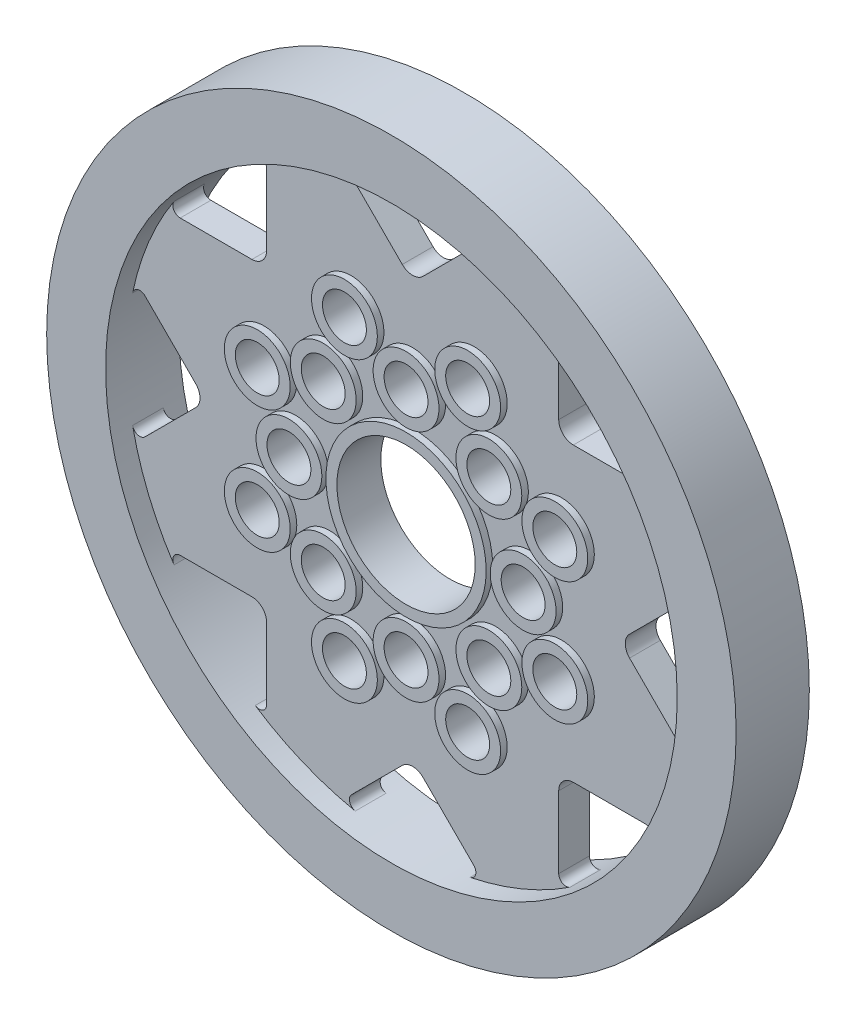
from build123d import *

# Parameters (mm, degrees)
SCHIZZO1_R                   = 23.5494
SCHIZZO1_R_2                 = 19.525
ESTRUSIONE_ESTRUSIONE1_DEPTH = 2.5
SCHIZZO2_R                   = 1.5
SCHIZZO2_R_2                 = 4.725
ESTRUSIONE_ESTRUSIONE2_DEPTH = 1.05
SCHIZZO3_R                   = 2.25
SCHIZZO3_R_2                 = 1.5
SCHIZZO3_R_3                 = 5.475
SCHIZZO3_R_4                 = 4.725
ESTRUSIONE_ESTRUSIONE3_DEPTH = 1.5


with BuildPart() as part:
    # Schizzo1 → Estrusione-Estrusione1 (new, symmetric)
    with BuildSketch(Plane.XY):
        Circle(SCHIZZO1_R)
        Circle(SCHIZZO1_R_2, mode=Mode.SUBTRACT)
    extrude(amount=ESTRUSIONE_ESTRUSIONE1_DEPTH, both=True)

    # Schizzo2 → Estrusione-Estrusione2 (add, symmetric)
    with BuildSketch(Plane.XY):
        with BuildLine():
            ThreePointArc((0.707106781, 14.817893219), (0, 14.525), (-0.707106781, 14.817893219))
            Line((-0.707106781, 14.817893219), (-4.173267549, 18.284053987))
            ThreePointArc((-4.173267549, 18.284053987), (-4.298603069, 18.78136207), (-3.920100864, 19.127426231))
            ThreePointArc((-3.920100864, 19.127426231), (-7.471894017, 18.038747872), (-10.75320289, 16.297062699))
            ThreePointArc((-10.75320289, 16.297062699), (-10.2408571, 16.319999859), (-9.977832778, 15.879724345))
            Line((-9.977832778, 15.879724345), (-9.977832778, 10.977832778))
            ThreePointArc((-9.977832778, 10.977832778), (-10.270725997, 10.270725997), (-10.977832778, 9.977832778))
            Line((-10.977832778, 9.977832778), (-15.879724345, 9.977832778))
            ThreePointArc((-15.879724345, 9.977832778), (-16.319999859, 10.2408571), (-16.297062699, 10.75320289))
            ThreePointArc((-16.297062699, 10.75320289), (-18.038747872, 7.471894017), (-19.127426231, 3.920100864))
            ThreePointArc((-19.127426231, 3.920100864), (-18.78136207, 4.298603069), (-18.284053987, 4.173267549))
            Line((-18.284053987, 4.173267549), (-14.817893219, 0.707106781))
            ThreePointArc((-14.817893219, 0.707106781), (-14.525, 0), (-14.817893219, -0.707106781))
            Line((-14.817893219, -0.707106781), (-18.284053987, -4.173267549))
            ThreePointArc((-18.284053987, -4.173267549), (-18.78136207, -4.298603069), (-19.127426231, -3.920100864))
            ThreePointArc((-19.127426231, -3.920100864), (-18.038747872, -7.471894017), (-16.297062699, -10.75320289))
            ThreePointArc((-16.297062699, -10.75320289), (-16.319999859, -10.2408571), (-15.879724345, -9.977832778))
            Line((-15.879724345, -9.977832778), (-10.977832778, -9.977832778))
            ThreePointArc((-10.977832778, -9.977832778), (-10.270725997, -10.270725997), (-9.977832778, -10.977832778))
            Line((-9.977832778, -10.977832778), (-9.977832778, -15.879724345))
            ThreePointArc((-9.977832778, -15.879724345), (-10.2408571, -16.319999859), (-10.75320289, -16.297062699))
            ThreePointArc((-10.75320289, -16.297062699), (-7.471894017, -18.038747872), (-3.920100864, -19.127426231))
            ThreePointArc((-3.920100864, -19.127426231), (-4.298603069, -18.78136207), (-4.173267549, -18.284053987))
            Line((-4.173267549, -18.284053987), (-0.707106781, -14.817893219))
            ThreePointArc((-0.707106781, -14.817893219), (0, -14.525), (0.707106781, -14.817893219))
            Line((0.707106781, -14.817893219), (4.173267549, -18.284053987))
            ThreePointArc((4.173267549, -18.284053987), (4.298603069, -18.78136207), (3.920100864, -19.127426231))
            ThreePointArc((3.920100864, -19.127426231), (7.471894017, -18.038747872), (10.75320289, -16.297062699))
            ThreePointArc((10.75320289, -16.297062699), (10.2408571, -16.319999859), (9.977832778, -15.879724345))
            Line((9.977832778, -15.879724345), (9.977832778, -10.977832778))
            ThreePointArc((9.977832778, -10.977832778), (10.270725997, -10.270725997), (10.977832778, -9.977832778))
            Line((10.977832778, -9.977832778), (15.879724345, -9.977832778))
            ThreePointArc((15.879724345, -9.977832778), (16.319999859, -10.2408571), (16.297062699, -10.75320289))
            ThreePointArc((16.297062699, -10.75320289), (18.038747872, -7.471894017), (19.127426231, -3.920100864))
            ThreePointArc((19.127426231, -3.920100864), (18.78136207, -4.298603069), (18.284053987, -4.173267549))
            Line((18.284053987, -4.173267549), (14.817893219, -0.707106781))
            ThreePointArc((14.817893219, -0.707106781), (14.525, 0), (14.817893219, 0.707106781))
            Line((14.817893219, 0.707106781), (18.284053987, 4.173267549))
            ThreePointArc((18.284053987, 4.173267549), (18.78136207, 4.298603069), (19.127426231, 3.920100864))
            ThreePointArc((19.127426231, 3.920100864), (18.038747872, 7.471894017), (16.297062699, 10.75320289))
            ThreePointArc((16.297062699, 10.75320289), (16.319999859, 10.2408571), (15.879724345, 9.977832778))
            Line((15.879724345, 9.977832778), (10.977832778, 9.977832778))
            ThreePointArc((10.977832778, 9.977832778), (10.270725997, 10.270725997), (9.977832778, 10.977832778))
            Line((9.977832778, 10.977832778), (9.977832778, 15.879724345))
            ThreePointArc((9.977832778, 15.879724345), (10.2408571, 16.319999859), (10.75320289, 16.297062699))
            ThreePointArc((10.75320289, 16.297062699), (7.471894017, 18.038747872), (3.920100864, 19.127426231))
            ThreePointArc((3.920100864, 19.127426231), (4.298603069, 18.78136207), (4.173267549, 18.284053987))
            Line((4.173267549, 18.284053987), (0.707106781, 14.817893219))
        make_face()
        with Locations((-4.209517756, -10.162674858)):
            Circle(SCHIZZO2_R, mode=Mode.SUBTRACT)
        with Locations((-10.162674858, -4.209517756)):
            Circle(SCHIZZO2_R, mode=Mode.SUBTRACT)
        with Locations((-5.656854249, -5.656854249)):
            Circle(SCHIZZO2_R, mode=Mode.SUBTRACT)
        with Locations((0, -8)):
            Circle(SCHIZZO2_R, mode=Mode.SUBTRACT)
        with Locations((4.209517756, -10.162674858)):
            Circle(SCHIZZO2_R, mode=Mode.SUBTRACT)
        with Locations((5.656854249, -5.656854249)):
            Circle(SCHIZZO2_R, mode=Mode.SUBTRACT)
        with Locations((8, 0)):
            Circle(SCHIZZO2_R, mode=Mode.SUBTRACT)
        with Locations((10.162674858, -4.209517756)):
            Circle(SCHIZZO2_R, mode=Mode.SUBTRACT)
        with Locations((-10.162674858, 4.209517756)):
            Circle(SCHIZZO2_R, mode=Mode.SUBTRACT)
        with Locations((-8, 0)):
            Circle(SCHIZZO2_R, mode=Mode.SUBTRACT)
        with Locations((-5.656854249, 5.656854249)):
            Circle(SCHIZZO2_R, mode=Mode.SUBTRACT)
        with Locations((-4.209517756, 10.162674858)):
            Circle(SCHIZZO2_R, mode=Mode.SUBTRACT)
        Circle(SCHIZZO2_R_2, mode=Mode.SUBTRACT)
        with Locations((0, 8)):
            Circle(SCHIZZO2_R, mode=Mode.SUBTRACT)
        with Locations((5.656854249, 5.656854249)):
            Circle(SCHIZZO2_R, mode=Mode.SUBTRACT)
        with Locations((10.162674858, 4.209517756)):
            Circle(SCHIZZO2_R, mode=Mode.SUBTRACT)
        with Locations((4.209517756, 10.162674858)):
            Circle(SCHIZZO2_R, mode=Mode.SUBTRACT)
    extrude(amount=ESTRUSIONE_ESTRUSIONE2_DEPTH, both=True)

    # Schizzo3 → Estrusione-Estrusione3 (add, symmetric)
    # profile 1 of 17: a face of its own
    with BuildSketch(Plane.XY):
        with Locations((-10.162674858, 4.209517756)):
            Circle(SCHIZZO3_R)
        with Locations((-10.162674858, 4.209517756)):
            Circle(SCHIZZO3_R_2, mode=Mode.SUBTRACT)
    # profile 2 of 17: a face of its own
    with BuildSketch(Plane.XY):
        with Locations((-5.656854249, 5.656854249)):
            Circle(SCHIZZO3_R)
        with Locations((-5.656854249, 5.656854249)):
            Circle(SCHIZZO3_R_2, mode=Mode.SUBTRACT)
    # profile 3 of 17: a face of its own
    with BuildSketch(Plane.XY):
        with Locations((-4.209517756, 10.162674858)):
            Circle(SCHIZZO3_R)
        with Locations((-4.209517756, 10.162674858)):
            Circle(SCHIZZO3_R_2, mode=Mode.SUBTRACT)
    # profile 4 of 17: a face of its own
    with BuildSketch(Plane.XY):
        with Locations((0, 8)):
            Circle(SCHIZZO3_R)
        with Locations((0, 8)):
            Circle(SCHIZZO3_R_2, mode=Mode.SUBTRACT)
    # profile 5 of 17: a face of its own
    with BuildSketch(Plane.XY):
        with Locations((4.209517756, 10.162674858)):
            Circle(SCHIZZO3_R)
        with Locations((4.209517756, 10.162674858)):
            Circle(SCHIZZO3_R_2, mode=Mode.SUBTRACT)
    # profile 6 of 17: a face of its own
    with BuildSketch(Plane.XY):
        with Locations((5.656854249, 5.656854249)):
            Circle(SCHIZZO3_R)
        with Locations((5.656854249, 5.656854249)):
            Circle(SCHIZZO3_R_2, mode=Mode.SUBTRACT)
    # profile 7 of 17: a face of its own
    with BuildSketch(Plane.XY):
        with Locations((10.162674858, 4.209517756)):
            Circle(SCHIZZO3_R)
        with Locations((10.162674858, 4.209517756)):
            Circle(SCHIZZO3_R_2, mode=Mode.SUBTRACT)
    # profile 8 of 17: a face of its own
    with BuildSketch(Plane.XY):
        with Locations((8, 0)):
            Circle(SCHIZZO3_R)
        with Locations((8, 0)):
            Circle(SCHIZZO3_R_2, mode=Mode.SUBTRACT)
    # profile 9 of 17: a face of its own
    with BuildSketch(Plane.XY):
        Circle(SCHIZZO3_R_3)
        Circle(SCHIZZO3_R_4, mode=Mode.SUBTRACT)
    # profile 10 of 17: a face of its own
    with BuildSketch(Plane.XY):
        with Locations((5.656854249, -5.656854249)):
            Circle(SCHIZZO3_R)
        with Locations((5.656854249, -5.656854249)):
            Circle(SCHIZZO3_R_2, mode=Mode.SUBTRACT)
    # profile 11 of 17: a face of its own
    with BuildSketch(Plane.XY):
        with Locations((10.162674858, -4.209517756)):
            Circle(SCHIZZO3_R)
        with Locations((10.162674858, -4.209517756)):
            Circle(SCHIZZO3_R_2, mode=Mode.SUBTRACT)
    # profile 12 of 17: a face of its own
    with BuildSketch(Plane.XY):
        with Locations((0, -8)):
            Circle(SCHIZZO3_R)
        with Locations((0, -8)):
            Circle(SCHIZZO3_R_2, mode=Mode.SUBTRACT)
    # profile 13 of 17: a face of its own
    with BuildSketch(Plane.XY):
        with Locations((-5.656854249, -5.656854249)):
            Circle(SCHIZZO3_R)
        with Locations((-5.656854249, -5.656854249)):
            Circle(SCHIZZO3_R_2, mode=Mode.SUBTRACT)
    # profile 14 of 17: a face of its own
    with BuildSketch(Plane.XY):
        with Locations((-8, 0)):
            Circle(SCHIZZO3_R)
        with Locations((-8, 0)):
            Circle(SCHIZZO3_R_2, mode=Mode.SUBTRACT)
    # profile 15 of 17: a face of its own
    with BuildSketch(Plane.XY):
        with Locations((-10.162674858, -4.209517756)):
            Circle(SCHIZZO3_R)
        with Locations((-10.162674858, -4.209517756)):
            Circle(SCHIZZO3_R_2, mode=Mode.SUBTRACT)
    # profile 16 of 17: a face of its own
    with BuildSketch(Plane.XY):
        with Locations((-4.209517756, -10.162674858)):
            Circle(SCHIZZO3_R)
        with Locations((-4.209517756, -10.162674858)):
            Circle(SCHIZZO3_R_2, mode=Mode.SUBTRACT)
    # profile 17 of 17: a face of its own
    with BuildSketch(Plane.XY):
        with Locations((4.209517756, -10.162674858)):
            Circle(SCHIZZO3_R)
        with Locations((4.209517756, -10.162674858)):
            Circle(SCHIZZO3_R_2, mode=Mode.SUBTRACT)
    extrude(amount=ESTRUSIONE_ESTRUSIONE3_DEPTH, both=True)


solid = part.part
